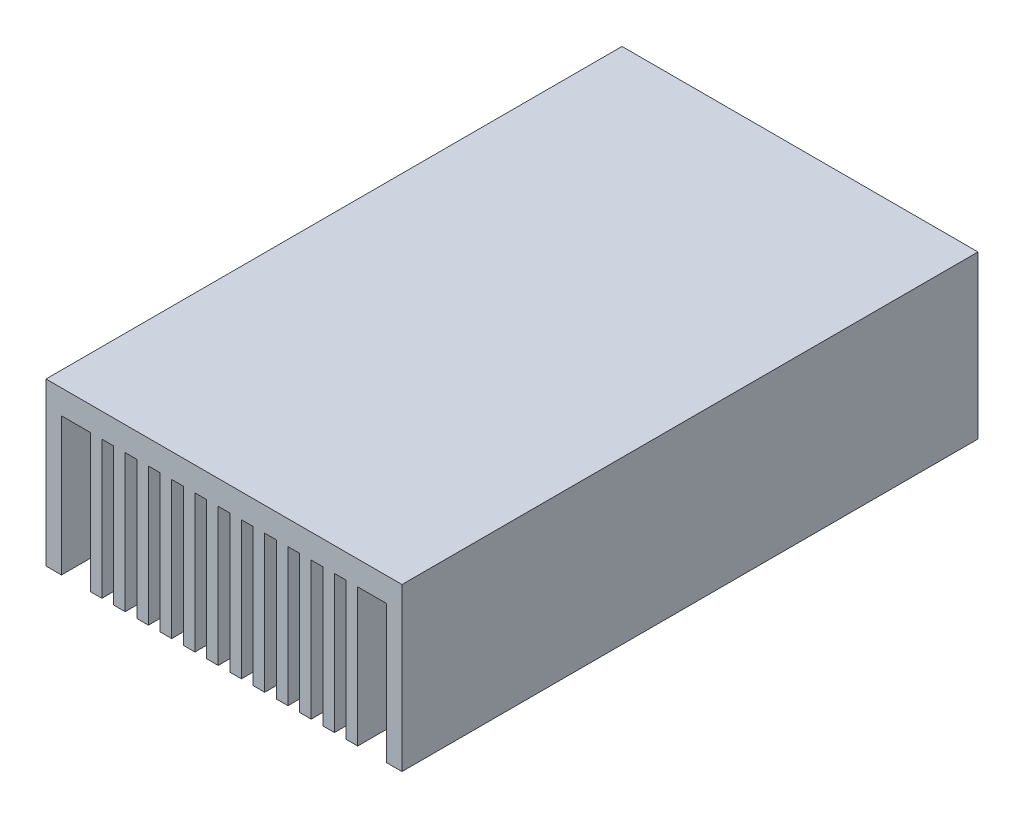
from build123d import *

# Parameters (mm, degrees)
BOSS_EXTRUDE1_DEPTH = 160
SKETCH4_W           = 3.229565218
SKETCH4_H           = 38.29
SKETCH4_W_2         = 3.229565217
CUT_EXTRUDE1_DEPTH  = 174.405056443


with BuildPart() as part:
    # Sketch1 → Boss-Extrude1 (new body)
    with BuildSketch(Plane.XY):
        Polygon((-49.44, -45), (-49.44, 0), (49.44, 0), (49.44, -45), (45.14, -45), (45.14, -6.71), (37.14, -6.71), (37.14, -45), (-37.14, -45), (-37.14, -6.71), (-45.14, -6.71), (-45.14, -45), align=None)
    extrude(amount=-BOSS_EXTRUDE1_DEPTH)

    # Sketch4 → Cut-Extrude1 (cut, through all)
    with BuildSketch(Plane.XY):
        with Locations((-32.295652174, -25.855)):
            Rectangle(SKETCH4_W, SKETCH4_H)
        with Locations((-25.836521739, -25.855)):
            Rectangle(SKETCH4_W, SKETCH4_H)
        with Locations((-19.377391305, -25.855)):
            Rectangle(SKETCH4_W_2, SKETCH4_H)
        with Locations((-12.91826087, -25.855)):
            Rectangle(SKETCH4_W_2, SKETCH4_H)
        with Locations((-6.459130435, -25.855)):
            Rectangle(SKETCH4_W_2, SKETCH4_H)
        with Locations((0, -25.855)):
            Rectangle(SKETCH4_W, SKETCH4_H)
        with Locations((6.459130435, -25.855)):
            Rectangle(SKETCH4_W_2, SKETCH4_H)
        with Locations((12.91826087, -25.855)):
            Rectangle(SKETCH4_W_2, SKETCH4_H)
        with Locations((19.377391305, -25.855)):
            Rectangle(SKETCH4_W_2, SKETCH4_H)
        with Locations((25.836521739, -25.855)):
            Rectangle(SKETCH4_W, SKETCH4_H)
        with Locations((32.295652174, -25.855)):
            Rectangle(SKETCH4_W, SKETCH4_H)
    extrude(amount=-CUT_EXTRUDE1_DEPTH, mode=Mode.SUBTRACT)


solid = part.part
